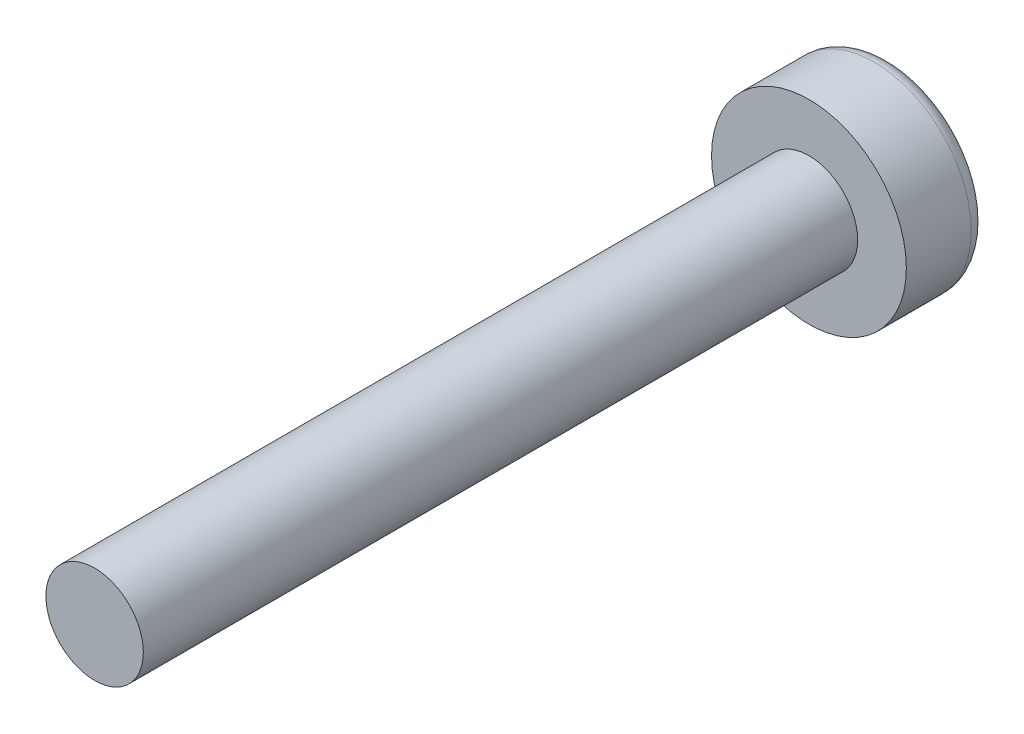
from build123d import *

# Parameters (mm, degrees)
ESQUISSE1_R             = 3
BASE_EXTRUSION_DEPTH    = 2.5
ESQUISSE2_R             = 1.5
BOSS_EXTRU_1_DEPTH      = 22
CONG_1_R                = 0.5
ENL_V_MAT_EXTRU_1_DEPTH = 2


with BuildPart() as part:
    # Esquisse1 → Base-Extrusion (new body)
    with BuildSketch(Plane.XY):
        Circle(ESQUISSE1_R)
    extrude(amount=BASE_EXTRUSION_DEPTH)

    # Esquisse2 → Boss.-Extru.1 (add)
    with BuildSketch(Plane.XY.offset(2.5)):
        Circle(ESQUISSE2_R)
    extrude(amount=BOSS_EXTRU_1_DEPTH)

    # Congé1
    cong_1_edges = [part.edges().sort_by_distance(p)[0] for p in [
        (-3, 0, 0),
    ]]
    fillet(cong_1_edges, radius=CONG_1_R)

    # Esquisse3 → Enlèv. mat.-Extru.1 (cut)
    with BuildSketch(Plane(origin=(0, 0, 0), x_dir=(-1, 0, 0), z_dir=(0, 0, -1))):
        Polygon((1.732050808, 0), (0.866025404, 1.5), (-0.866025404, 1.5), (-1.732050808, 0), (-0.866025404, -1.5), (0.866025404, -1.5), align=None)
    extrude(amount=-ENL_V_MAT_EXTRU_1_DEPTH, mode=Mode.SUBTRACT)


solid = part.part
